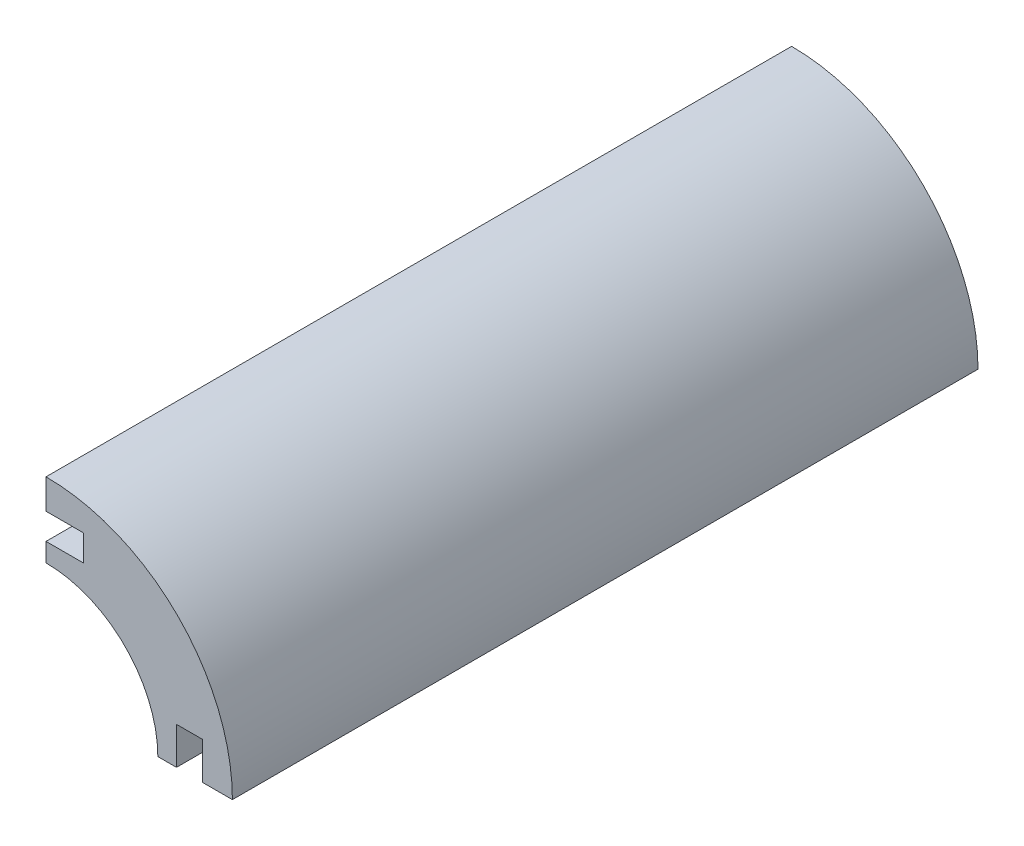
from build123d import *

# Parameters (mm, degrees)
BOSS_EXTRU_1_DEPTH     = 200
D_GAGEMENT_M3_52_D     = 4.2
D_GAGEMENT_M3_52_DEPTH = 50
D_GAGEMENT_M3_52_TIP   = 1.2618073


with BuildPart() as part:
    # Esquisse2 → Boss.-Extru.1 (new body)
    with BuildSketch(Plane.XY):
        with BuildLine():
            Line((30, 0), (35, 0))
            Line((35, 0), (35, 10))
            Line((35, 10), (42, 10))
            Line((42, 10), (42, 0))
            Line((42, 0), (50, 0))
            ThreePointArc((50, 0), (35.355339059, 35.355339059), (0, 50))
            Line((0, 50), (0, 42))
            Line((0, 42), (10, 42))
            Line((10, 42), (10, 35))
            Line((10, 35), (0, 35))
            Line((0, 35), (0, 30))
            ThreePointArc((0, 30), (21.213203436, 21.213203436), (30, 0))
        make_face()
    extrude(amount=-BOSS_EXTRU_1_DEPTH)

    # Dégagement M3.52
    with Locations(Plane(origin=(0, 0, -200), x_dir=(-1, 0, 0), z_dir=(0, 0, -1))):
        with Locations((-28.284271247, 28.284271247)):
            Hole(D_GAGEMENT_M3_52_D / 2, depth=D_GAGEMENT_M3_52_DEPTH)
            with Locations((0, 0, -(D_GAGEMENT_M3_52_DEPTH + D_GAGEMENT_M3_52_TIP / 2))):  # 118° drill point
                Cone(0, D_GAGEMENT_M3_52_D / 2, D_GAGEMENT_M3_52_TIP, mode=Mode.SUBTRACT)


solid = part.part
